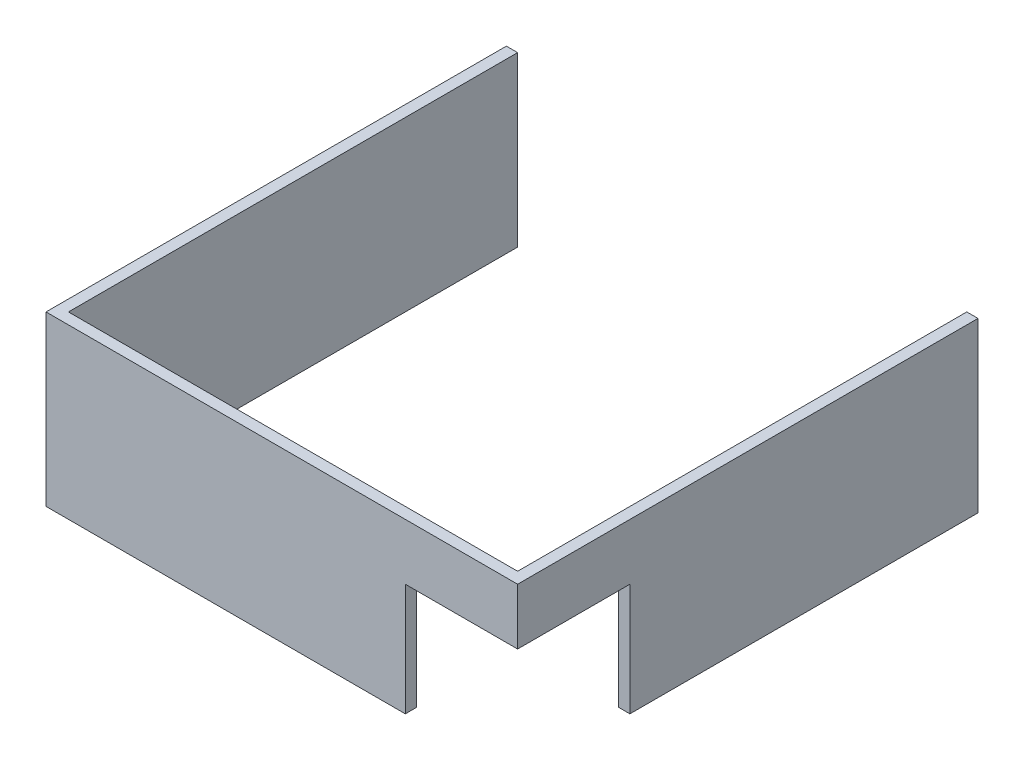
from build123d import *

# Parameters (mm, degrees)
BOSS_EXTRUDE1_DEPTH = 30
SKETCH2_W           = 20
SKETCH2_H           = 20
CUT_EXTRUDE1_DEPTH  = 20


with BuildPart() as part:
    # Sketch1 → Boss-Extrude1 (new body)
    with BuildSketch(Plane(origin=(0, 0, 0), x_dir=(1, 0, 0), z_dir=(0, 1, 0))):
        Polygon((0, 0), (80, 0), (80, 80), (82, 80), (82, -2), (80, -2), (-2, -2), (-2, 80), (0, 80), align=None)
    extrude(amount=BOSS_EXTRUDE1_DEPTH)

    # Sketch2 → Cut-Extrude1 (cut)
    with BuildSketch(Plane(origin=(82, 0, 0), x_dir=(0, 0, -1), z_dir=(1, 0, 0))):
        with Locations((8, 10)):
            Rectangle(SKETCH2_W, SKETCH2_H)
    extrude(amount=-CUT_EXTRUDE1_DEPTH, mode=Mode.SUBTRACT)


solid = part.part
